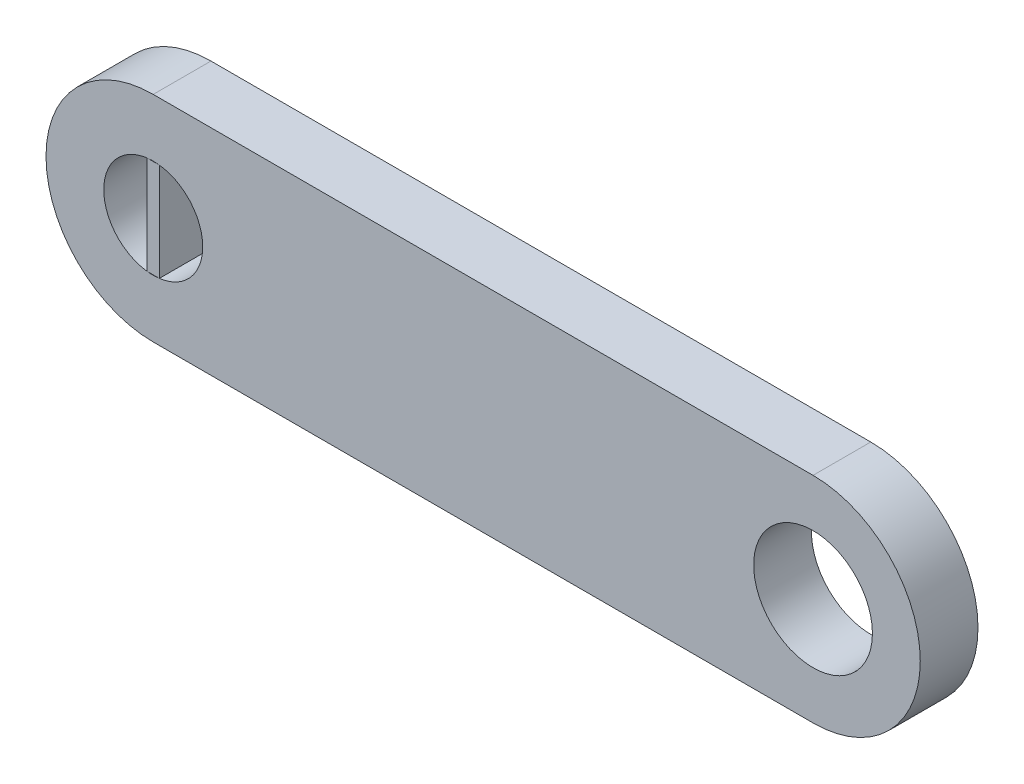
from build123d import *

# Parameters (mm, degrees)
SKETCH_1_R        = 3.6
SKETCH_1_R_2      = 3
EXTRUDE_3_DEPTH   = 3.5
SKETCH_1_W        = 0.75
SKETCH_1_H        = 5.95294045
EXTRUDE_3_2_DEPTH = 3.5


with BuildPart() as part:
    # 草图1 → 凸台-拉伸3 (new body)
    with BuildSketch(Plane.XY):
        with BuildLine():
            Line((-20, -6.5), (20, -6.5))
            ThreePointArc((20, -6.5), (26.5, 0), (20, 6.5))
            Line((20, 6.5), (-20, 6.5))
            ThreePointArc((-20, 6.5), (-26.5, 0), (-20, -6.5))
        make_face()
        with Locations((20, 0)):
            Circle(SKETCH_1_R, mode=Mode.SUBTRACT)
        with Locations((-20, 0)):
            Circle(SKETCH_1_R_2, mode=Mode.SUBTRACT)
    extrude(amount=EXTRUDE_3_DEPTH)


with BuildPart() as body_2:
    # 草图1 → Extrude 3 2 (new body)
    with BuildSketch(Plane.XY):
        with Locations((-20, 0)):
            Rectangle(SKETCH_1_W, SKETCH_1_H)
    extrude(amount=EXTRUDE_3_2_DEPTH)


solid = Compound([part.part, body_2.part])
